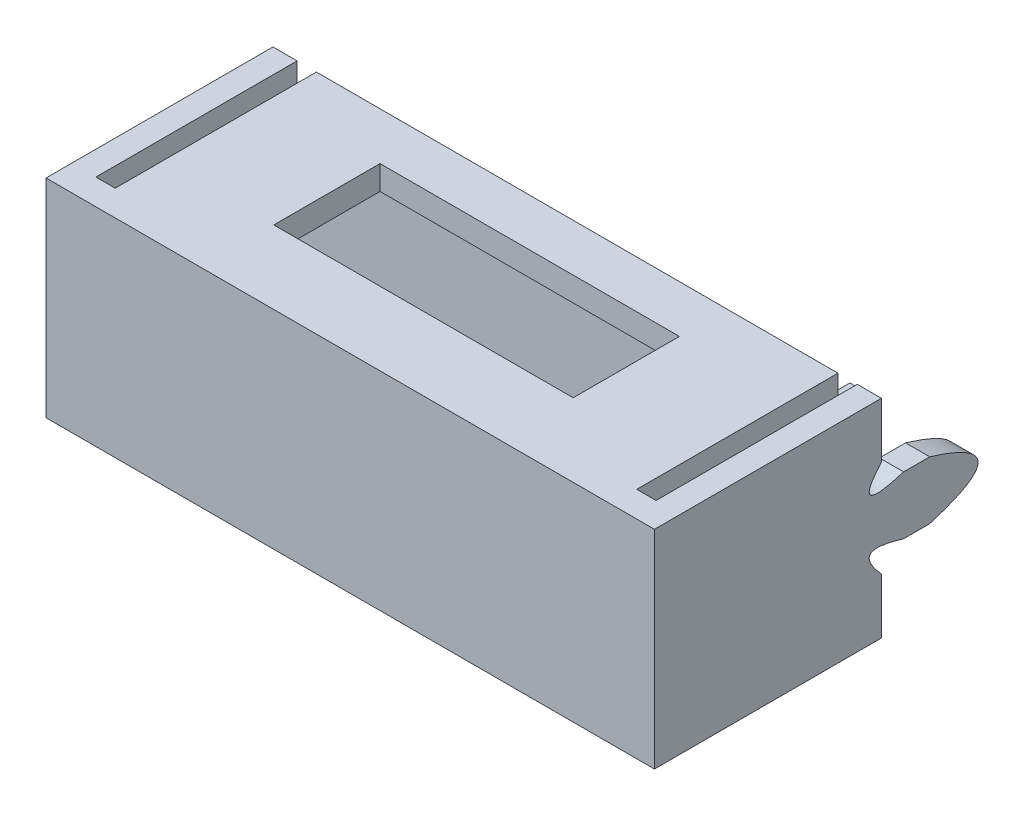
from build123d import *

# Parameters (mm, degrees)
SKETCH_1_W           = 12.6
SKETCH_1_H           = 4.3
SKETCH_1_W_2         = 11.6
SKETCH_1_H_2         = 3.3
EXTRUDE_1_DEPTH      = 4.7
SKETCH_4_W           = 11.6
SKETCH_4_H           = 3.3
EXTRUDE_3_DEPTH      = 0.5
SKETCH_6_W           = 0.4
SKETCH_6_H           = 4.166312425
CUT_EXTRUDE_2_DEPTH  = 9.959352655
EXTRUDE_4_DEPTH      = 0.8
EXTRUDE_4_DEPTH_BACK = 0.1
SKETCH_7_W           = 11.6
SKETCH_7_H           = 3.3
EXTRUDE_START        = -0.1
SKETCH_8_W           = 0.5
SKETCH_8_H           = 0.4
EXTRUDE_5_DEPTH      = 2
SKETCH_9_W           = 6.2
SKETCH_9_H           = 2.2
CUT_EXTRUDE_3_DEPTH  = 0.5
CUT_EXTRUDE_4_DEPTH  = 0.5
CUT_EXTRUDE_START    = -12.6
CUT_EXTRUDE_5_DEPTH  = 0.5
CHAMFER_1_SIZE       = 0.1


with BuildPart() as part:
    # 草图1 → 拉伸-薄壁1 (new body)
    with BuildSketch(Plane.XY):
        Rectangle(SKETCH_1_W, SKETCH_1_H)
        Rectangle(SKETCH_1_W_2, SKETCH_1_H_2, mode=Mode.SUBTRACT)
    extrude(amount=EXTRUDE_1_DEPTH)

    # 草图4 → 凸台-拉伸3 (add)
    with BuildSketch(Plane.XY.offset(4.7)):
        Rectangle(SKETCH_4_W, SKETCH_4_H)
    extrude(amount=-EXTRUDE_3_DEPTH)

    # 草图6 → 切除-拉伸2 (cut, through all)
    with BuildSketch(Plane.XZ.offset(2.15)):
        with Locations((-5.6, 2.083156213)):
            Rectangle(SKETCH_6_W, SKETCH_6_H)
        with Locations((5.6, 2.083156213)):
            Rectangle(SKETCH_6_W, SKETCH_6_H)
    extrude(amount=-CUT_EXTRUDE_2_DEPTH, mode=Mode.SUBTRACT)



with BuildPart() as body_2:
    # 草图7 → 凸台-拉伸4 (new, two sides: drawn at the far end of the back side and taken through both)
    with BuildSketch(Plane.XY.offset(-EXTRUDE_4_DEPTH_BACK)):
        Rectangle(SKETCH_7_W, SKETCH_7_H)
    extrude(amount=EXTRUDE_4_DEPTH + EXTRUDE_4_DEPTH_BACK)


with BuildPart() as part_1:
    add(part.part)

    add(body_2.part)  # 凸台-拉伸5 merges body 2
    # 草图8 → 凸台-拉伸5 (add)
    with BuildSketch(Plane(origin=(0, 0, -0.1), x_dir=(-1, 0, 0), z_dir=(0, 0, -1)).offset(EXTRUDE_START)):
        with Locations((4, 0)):
            Rectangle(SKETCH_8_W, SKETCH_8_H)
        with Locations((2, 0)):
            Rectangle(SKETCH_8_W, SKETCH_8_H)
        Rectangle(SKETCH_8_W, SKETCH_8_H)
        with Locations((-4, 0)):
            Rectangle(SKETCH_8_W, SKETCH_8_H)
        Polygon((-5.8, 0), (-5.8, 0.6), (-6.3, 0.6), (-6.3, -0.6), (-5.8, -0.6), align=None)
        Polygon((5.8, -0.6), (5.8, 0), (5.8, 0.6), (6.3, 0.6), (6.3, -0.6), align=None)
    extrude(amount=EXTRUDE_5_DEPTH)

    # 草图9 → 切除-拉伸3 (cut)
    with BuildSketch(Plane(origin=(0, 2.15, 0), x_dir=(1, 0, 0), z_dir=(0, 1, 0))):
        with Locations((0, -2.083156212)):
            Rectangle(SKETCH_9_W, SKETCH_9_H)
    extrude(amount=-CUT_EXTRUDE_3_DEPTH, mode=Mode.SUBTRACT)

    # 草图10 → 切除-拉伸4 (cut)
    with BuildSketch(Plane(origin=(6.3, 0, 0), x_dir=(0, 0, -1), z_dir=(1, 0, 0))):
        with BuildLine():
            Line((0, 1.000258095), (0.460284105, 0.6))
            add(Edge.make_bspline(
                [(0.460284105, 0.6), (-0.677187697, 0.248999902), (0, 1.000258095)],
                knots=[0, 0, 0, 1, 1, 1], degree=2))
        make_face()
        with BuildLine():
            Line((0.460284105, -0.6), (0, -1.000258095))
            add(Edge.make_bspline(
                [(0.460284105, -0.6), (-0.677187697, -0.248999902), (0, -1.000258095)],
                knots=[0, 0, 0, 1, 1, 1], degree=2))
        make_face()
        with BuildLine():
            Line((1, 0.6), (4, 0.6))
            Line((4, 0.6), (4.247891551, 0.6))
            Line((4.247891551, 0.6), (4.247891551, -0.6))
            Line((4.247891551, -0.6), (1, -0.6))
            add(Edge.make_bspline(
                [(1, 0.6), (3, 0), (1, -0.6)],
                knots=[0, 0, 0, 1, 1, 1], degree=2))
        make_face()
    extrude(amount=-CUT_EXTRUDE_4_DEPTH, mode=Mode.SUBTRACT)

    # 草图10<2> → 切除-拉伸5 (cut)
    with BuildSketch(Plane(origin=(6.3, 0, 0), x_dir=(0, 0, -1), z_dir=(1, 0, 0)).offset(CUT_EXTRUDE_START)):
        with BuildLine():
            Line((0, 1.000258095), (0.460284105, 0.6))
            add(Edge.make_bspline(
                [(0.460284105, 0.6), (-0.677187697, 0.248999902), (0, 1.000258095)],
                knots=[0, 0, 0, 1, 1, 1], degree=2))
        make_face()
        with BuildLine():
            Line((0.460284105, -0.6), (0, -1.000258095))
            add(Edge.make_bspline(
                [(0.460284105, -0.6), (-0.677187697, -0.248999902), (0, -1.000258095)],
                knots=[0, 0, 0, 1, 1, 1], degree=2))
        make_face()
        with BuildLine():
            Line((1, 0.6), (4, 0.6))
            Line((4, 0.6), (4.247891551, 0.6))
            Line((4.247891551, 0.6), (4.247891551, -0.6))
            Line((4.247891551, -0.6), (1, -0.6))
            add(Edge.make_bspline(
                [(1, 0.6), (3, 0), (1, -0.6)],
                knots=[0, 0, 0, 1, 1, 1], degree=2))
        make_face()
    extrude(amount=CUT_EXTRUDE_5_DEPTH, mode=Mode.SUBTRACT)

    # 倒角1
    chamfer_1_edges = [part_1.edges().sort_by_distance(p)[0] for p in [
        (-4, 0.2, -2),
        (-3.75, 0, -2),
        (-4, -0.2, -2),
        (-4.25, 0, -2),
        (-2, 0.2, -2),
        (-1.75, 0, -2),
        (-2, -0.2, -2),
        (-2.25, 0, -2),
        (4, 0.2, -2),
        (4.25, 0, -2),
        (4, -0.2, -2),
        (3.75, 0, -2),
        (0, 0.2, -2),
        (0.25, 0, -2),
        (0, -0.2, -2),
        (-0.25, 0, -2),
    ]]
    chamfer(chamfer_1_edges, length=CHAMFER_1_SIZE)


solid = part_1.part
